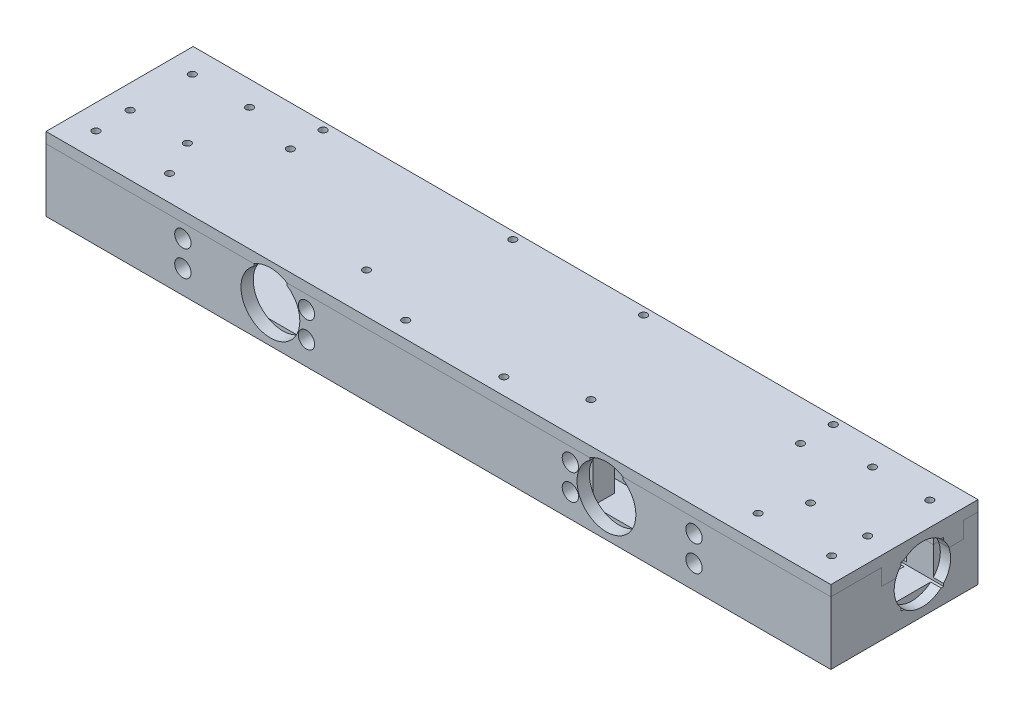
from build123d import *

# Parameters (mm, degrees)
BOSS_EXTRUDE1_DEPTH      = 152.4
BOSS_EXTRUDE1_DEPTH_BACK = 152.4
SKETCH3_W                = 57.15
SKETCH3_H                = 28.575
SKETCH6_W                = 16.51
SKETCH6_H                = 16.51
CUT_EXTRUDE2_DEPTH       = 16.9164
SKETCH7_R                = 10.9728
CUT_EXTRUDE3_DEPTH       = 4.0132
CUT_EXTRUDE4_START       = 2.54
SKETCH8_R                = 10.9728
CUT_EXTRUDE4_DEPTH       = 2.54
CUT_EXTRUDE5_DEPTH       = 25.4
SPLIT1_SURFACE_1_BACK    = 312.425
SPLIT1_SURFACE_1_DEPTH   = 624.85
SPLIT1_SURFACE_2_BACK    = 312.425
SPLIT1_SURFACE_2_DEPTH   = 624.85
CUT_EXTRUDE7_START       = 4.1275
CUT_EXTRUDE7_DEPTH       = 20.32
CUT_EXTRUDE8_DEPTH       = 4.7625
SKETCH16_W               = 7.62
SKETCH16_H               = 5.08
CUT_EXTRUDE9_DEPTH       = 20.32
SKETCH17_W               = 7.62
SKETCH17_H               = 25.6775
BOSS_EXTRUDE2_DEPTH      = 6.35
SKETCH18_W               = 55.24
SKETCH18_H               = 6.0725
BOSS_EXTRUDE3_DEPTH      = 9.525
SKETCH19_W               = 8
SKETCH19_H               = 7.62
CUT_EXTRUDE10_DEPTH      = 7.62
SKETCH20_R               = 3.175
CUT_EXTRUDE11_DEPTH      = 18.1625
SKETCH21_R               = 1.397
CUT_EXTRUDE12_DEPTH      = 25.4
SKETCH28_R               = 11.43
CUT_EXTRUDE16_DEPTH      = 4.7625
BOSS_EXTRUDE5_REACH      = 160.392
SKETCH23_W               = 7.2136
SKETCH23_H               = 6.35
SKETCH24_W               = 55.24
SKETCH24_H               = 6.0725
BOSS_EXTRUDE6_DEPTH      = 3.175
SKETCH25_W               = 205.74
SKETCH25_H               = 25.6775
CUT_EXTRUDE13_DEPTH      = 6.35
SKETCH26_R               = 1.397
CUT_EXTRUDE14_DEPTH      = 25.4
CUT_EXTRUDE15_DEPTH      = 20.32
CUT_EXTRUDE17_DEPTH      = 4.7625


with BuildPart() as part:
    # Sketch3 → Boss-Extrude1 (new, two sides: drawn at the far end of the back side and taken through both)
    with BuildSketch(Plane(origin=(0, 0, 0), x_dir=(0, 0, -1), z_dir=(1, 0, 0)).offset(-BOSS_EXTRUDE1_DEPTH_BACK)):
        with Locations((-6.985, 25.4)):
            Rectangle(SKETCH3_W, SKETCH3_H)
    extrude(amount=BOSS_EXTRUDE1_DEPTH + BOSS_EXTRUDE1_DEPTH_BACK)

    # Sketch6 → Cut-Extrude2 (cut)
    with BuildSketch(Plane(origin=(152.4, 0, 0), x_dir=(0, 0, -1), z_dir=(1, 0, 0))):
        with Locations((0, 25.4)):
            Rectangle(SKETCH6_W, SKETCH6_H)
    cut_extrude2 = extrude(amount=-CUT_EXTRUDE2_DEPTH, mode=Mode.SUBTRACT)

    # Sketch7 → Cut-Extrude3 (cut)
    with BuildSketch(Plane(origin=(152.4, 0, 0), x_dir=(0, 0, -1), z_dir=(1, 0, 0))):
        with Locations((0, 25.4)):
            Circle(SKETCH7_R)
    cut_extrude3 = extrude(amount=-CUT_EXTRUDE3_DEPTH, mode=Mode.SUBTRACT)

    # Sketch8 → Cut-Extrude4 (cut)
    with BuildSketch(Plane(origin=(135.4836, 0, 0), x_dir=(0, 0, -1), z_dir=(1, 0, 0)).offset(CUT_EXTRUDE4_START)):
        with Locations((0, 25.4)):
            Circle(SKETCH8_R)
    cut_extrude4 = extrude(amount=-CUT_EXTRUDE4_DEPTH, mode=Mode.SUBTRACT)

    # Sketch9 → Cut-Extrude5 (cut)
    with BuildSketch(Plane(origin=(135.4836, 0, 0), x_dir=(0, 0, -1), z_dir=(1, 0, 0))):
        with BuildLine():
            Line((7.74954, 32.033075169), (7.74954, 18.766924831))
            ThreePointArc((7.74954, 18.766924831), (0, 15.19936), (-7.74954, 18.766924831))
            Line((-7.74954, 18.766924831), (-7.74954, 32.033075169))
            ThreePointArc((-7.74954, 32.033075169), (0, 35.60064), (7.74954, 32.033075169))
        make_face()
    cut_extrude5 = extrude(amount=-CUT_EXTRUDE5_DEPTH, mode=Mode.SUBTRACT)

    # Mirror1: Cut-Extrude2, Cut-Extrude3, Cut-Extrude4, Cut-Extrude5 across Right Plane
    add(cut_extrude2.mirror(Plane(origin=(0, 0, 0), x_dir=(0, 0, -1), z_dir=(1, 0, 0))), mode=Mode.SUBTRACT)
    add(cut_extrude3.mirror(Plane(origin=(0, 0, 0), x_dir=(0, 0, -1), z_dir=(1, 0, 0))), mode=Mode.SUBTRACT)
    add(cut_extrude4.mirror(Plane(origin=(0, 0, 0), x_dir=(0, 0, -1), z_dir=(1, 0, 0))), mode=Mode.SUBTRACT)
    add(cut_extrude5.mirror(Plane(origin=(0, 0, 0), x_dir=(0, 0, -1), z_dir=(1, 0, 0))), mode=Mode.SUBTRACT)


with BuildPart() as body_2:
    # Split1: the piece behind the surface
    add(part.part)
    # Split1 surface: a surface, the sketch's curves swept straight by 624.85 mm
    with BuildLine(Plane(origin=(0, 0, 0), x_dir=(0, 0, -1), z_dir=(1, 0, 0)).offset(-SPLIT1_SURFACE_1_BACK), mode=Mode.PRIVATE) as split1_surface_1_path:
        Line((-35.56, 35.56), (-15.875, 35.56))
        Line((-15.875, 35.56), (-15.875, 29.21))
        Line((-15.875, 29.21), (0, 29.21))
        Line((0, 29.21), (15.875, 29.21))
        Line((15.875, 29.21), (15.875, 35.56))
        Line((15.875, 35.56), (21.59, 35.56))
    split1_surface_1 = Shell.extrude(split1_surface_1_path.wire(), (1 * SPLIT1_SURFACE_1_DEPTH, 0 * SPLIT1_SURFACE_1_DEPTH, 0 * SPLIT1_SURFACE_1_DEPTH))
    split(bisect_by=split1_surface_1, keep=Keep.BOTTOM)


with BuildPart() as part_1:
    add(part.part)

    # Split1: split by a surface, the side it looks to stays
    # Split1 surface: a surface, the sketch's curves swept straight by 624.85 mm
    with BuildLine(Plane(origin=(0, 0, 0), x_dir=(0, 0, -1), z_dir=(1, 0, 0)).offset(-SPLIT1_SURFACE_2_BACK), mode=Mode.PRIVATE) as split1_surface_2_path:
        Line((-35.56, 35.56), (-15.875, 35.56))
        Line((-15.875, 35.56), (-15.875, 29.21))
        Line((-15.875, 29.21), (0, 29.21))
        Line((0, 29.21), (15.875, 29.21))
        Line((15.875, 29.21), (15.875, 35.56))
        Line((15.875, 35.56), (21.59, 35.56))
    split1_surface_2 = Shell.extrude(split1_surface_2_path.wire(), (1 * SPLIT1_SURFACE_2_DEPTH, 0 * SPLIT1_SURFACE_2_DEPTH, 0 * SPLIT1_SURFACE_2_DEPTH))
    split(bisect_by=split1_surface_2, keep=Keep.TOP)


with BuildPart() as cut_extrude7_tool:
    # Sketch13 → Cut-Extrude7 (new body)
    with BuildSketch(Plane(origin=(0, 11.1125, 0), x_dir=(1, 0, 0), z_dir=(0, 1, 0)).offset(CUT_EXTRUDE7_START)):
        Polygon((-102.87, -15.875), (-102.87, 9.8025), (-95.25, 9.8025), (-95.25, -30.7975), (-55.25, -30.7975), (-55.25, 9.8025), (-47.63, 9.8025), (-47.63, -15.875), (47.63, -15.875), (47.63, 9.8025), (55.25, 9.8025), (55.25, -30.7975), (95.25, -30.7975), (95.25, 9.8025), (102.87, 9.8025), (102.87, -15.875), (110.0836, -15.875), (110.0836, 15.875), (-110.0836, 15.875), (-110.0836, -15.875), align=None)
    extrude(amount=CUT_EXTRUDE7_DEPTH)


with BuildPart() as part_2:
    add(part_1.part)

    # Cut-Extrude7: cut by cut_extrude7_tool
    add(cut_extrude7_tool.part, mode=Mode.SUBTRACT)

    # Sketch24 → Boss-Extrude6 (add)
    with BuildSketch(Plane.XZ.offset(-35.56)):
        with Locations((-75.25, -12.83875)):
            Rectangle(SKETCH24_W, SKETCH24_H)
        with Locations((75.25, -12.83875)):
            Rectangle(SKETCH24_W, SKETCH24_H)
    extrude(amount=BOSS_EXTRUDE6_DEPTH)

    # Sketch25 → Cut-Extrude13 (cut)
    with BuildSketch(Plane.XZ.offset(-29.21)):
        with Locations((0, 3.03625)):
            Rectangle(SKETCH25_W, SKETCH25_H)
    extrude(amount=-CUT_EXTRUDE13_DEPTH, mode=Mode.SUBTRACT)


with BuildPart() as body_2_1:
    add(body_2.part)

    # Cut-Extrude7: cut by cut_extrude7_tool
    add(cut_extrude7_tool.part, mode=Mode.SUBTRACT)

    # Sketch15 → Cut-Extrude8 (cut)
    with BuildSketch(Plane.XY.offset(35.56)):
        with BuildLine():
            Line((-71.7, 25.24), (-71.7, 35.56))
            Line((-71.7, 35.56), (-58.8, 35.56))
            Line((-58.8, 35.56), (-58.8, 25.24))
            ThreePointArc((-58.8, 25.24), (-65.25, 18.79), (-71.7, 25.24))
        make_face()
    cut_extrude8 = extrude(amount=-CUT_EXTRUDE8_DEPTH, mode=Mode.SUBTRACT)

    # Sketch16 → Cut-Extrude9 (cut)
    with BuildSketch(Plane(origin=(0, 35.56, 0), x_dir=(1, 0, 0), z_dir=(0, 1.0, 1.17890261829277e-12))):
        with Locations((-99.06, -19.9375)):
            Rectangle(SKETCH16_W, SKETCH16_H)
        with Locations((-51.44, -19.9375)):
            Rectangle(SKETCH16_W, SKETCH16_H)
    cut_extrude9 = extrude(amount=-CUT_EXTRUDE9_DEPTH, mode=Mode.SUBTRACT)

    # Sketch17 → Boss-Extrude2 (add)
    with BuildSketch(Plane(origin=(0, 29.21, 0), x_dir=(1, 0, 0), z_dir=(0, 1, 0))):
        with Locations((-99.06, -3.03625)):
            Rectangle(SKETCH17_W, SKETCH17_H)
        with Locations((-51.44, -3.03625)):
            Rectangle(SKETCH17_W, SKETCH17_H)
    boss_extrude2 = extrude(amount=BOSS_EXTRUDE2_DEPTH)

    # Sketch18 → Boss-Extrude3 (add)
    with BuildSketch(Plane(origin=(0, 15.24, 0), x_dir=(1, 0, 0), z_dir=(0, 1, 0))):
        with Locations((-75.25, 12.83875)):
            Rectangle(SKETCH18_W, SKETCH18_H)
    boss_extrude3 = extrude(amount=BOSS_EXTRUDE3_DEPTH)

    # Sketch19 → Cut-Extrude10 (cut)
    with BuildSketch(Plane.ZY.offset(55.25)):
        with Locations((-5.8025, 25.4)):
            Rectangle(SKETCH19_W, SKETCH19_H)
    cut_extrude10 = extrude(amount=-CUT_EXTRUDE10_DEPTH, mode=Mode.SUBTRACT)

    # Sketch20 → Cut-Extrude11 (cut)
    with BuildSketch(Plane.XY.offset(35.56)):
        with Locations((-99.25, 20.24)):
            Circle(SKETCH20_R)
        with Locations((-99.25, 30.24)):
            Circle(SKETCH20_R)
        with Locations((-51.25, 20.24)):
            Circle(SKETCH20_R)
        with Locations((-51.25, 30.24)):
            Circle(SKETCH20_R)
    cut_extrude11 = extrude(amount=-CUT_EXTRUDE11_DEPTH, mode=Mode.SUBTRACT)

    # Sketch21 → Cut-Extrude12 (cut)
    with BuildSketch(Plane.XY.offset(17.3975)):
        with Locations(Location((-99.25, 30.24, 0), (0, 0, 270))):
            Circle(SKETCH21_R)
        with Locations(Location((-99.25, 20.24, 0), (0, 0, 270))):
            Circle(SKETCH21_R)
        with Locations(Location((-51.25, 20.24, 0), (0, 0, 270))):
            Circle(SKETCH21_R)
        with Locations(Location((-51.25, 30.24, 0), (0, 0, 270))):
            Circle(SKETCH21_R)
    cut_extrude12 = extrude(amount=-CUT_EXTRUDE12_DEPTH, mode=Mode.SUBTRACT)

    # Sketch28 → Cut-Extrude16 (cut)
    with BuildSketch(Plane.XY.offset(35.56)):
        with Locations((-65.25, 25.24)):
            Circle(SKETCH28_R)
    cut_extrude16 = extrude(amount=-CUT_EXTRUDE16_DEPTH, mode=Mode.SUBTRACT)

    # Mirror2: Cut-Extrude8, Cut-Extrude9 across plane
    add(cut_extrude8.mirror(Plane(origin=(0, 0, 0), x_dir=(0, 0, 1), z_dir=(1, 0, 0))), mode=Mode.SUBTRACT)
    add(cut_extrude9.mirror(Plane(origin=(0, 0, 0), x_dir=(0, 0, 1), z_dir=(1, 0, 0))), mode=Mode.SUBTRACT)

    # Mirror2 2: Boss-Extrude2, Boss-Extrude3 across plane
    add(boss_extrude2.mirror(Plane(origin=(0, 0, 0), x_dir=(0, 0, 1), z_dir=(1, 0, 0))))
    add(boss_extrude3.mirror(Plane(origin=(0, 0, 0), x_dir=(0, 0, 1), z_dir=(1, 0, 0))))

    # Mirror2 3: Cut-Extrude10, Cut-Extrude11, Cut-Extrude12, Cut-Extrude16 across plane
    add(cut_extrude10.mirror(Plane(origin=(0, 0, 0), x_dir=(0, 0, 1), z_dir=(1, 0, 0))), mode=Mode.SUBTRACT)
    add(cut_extrude11.mirror(Plane(origin=(0, 0, 0), x_dir=(0, 0, 1), z_dir=(1, 0, 0))), mode=Mode.SUBTRACT)
    add(cut_extrude12.mirror(Plane(origin=(0, 0, 0), x_dir=(0, 0, 1), z_dir=(1, 0, 0))), mode=Mode.SUBTRACT)
    add(cut_extrude16.mirror(Plane(origin=(0, 0, 0), x_dir=(0, 0, 1), z_dir=(1, 0, 0))), mode=Mode.SUBTRACT)

    # Boss-Extrude5: up to this face of the body (flat: up to its plane)
    boss_extrude5_end = Plane(body_2_1.part.faces().sort_by_distance((-75.25, 15.24, 10.4975))[0])
    # Sketch23 → Boss-Extrude5 (add, up to the picked face)
    with BuildSketch(Plane(origin=(0, 35.56, 0), x_dir=(1, 0, 0), z_dir=(0, 1.0, 1.17890261829277e-12)), mode=Mode.PRIVATE) as boss_extrude5_sk1:
        with Locations((-106.4768, -12.7)):
            Rectangle(SKETCH23_W, SKETCH23_H)
    boss_extrude5_tool1 = split(extrude(boss_extrude5_sk1.sketch, amount=-BOSS_EXTRUDE5_REACH, mode=Mode.PRIVATE), bisect_by=boss_extrude5_end, keep=Keep.BOTH, mode=Mode.PRIVATE)
    # Sketch23 → Boss-Extrude5 (add, up to the picked face)
    with BuildSketch(Plane(origin=(0, 35.56, 0), x_dir=(1, 0, 0), z_dir=(0, 1.0, 1.17890261829277e-12)), mode=Mode.PRIVATE) as boss_extrude5_sk2:
        with Locations((106.4768, -12.7)):
            Rectangle(SKETCH23_W, SKETCH23_H)
    boss_extrude5_tool2 = split(extrude(boss_extrude5_sk2.sketch, amount=-BOSS_EXTRUDE5_REACH, mode=Mode.PRIVATE), bisect_by=boss_extrude5_end, keep=Keep.BOTH, mode=Mode.PRIVATE)
    add(boss_extrude5_tool1.solids().sort_by(Axis((-106.4768, 35.56, 12.7), (0, -1.0, -1.17890261829277e-12)))[0])
    add(boss_extrude5_tool2.solids().sort_by(Axis((106.4768, 35.56, 12.7), (0, -1.0, -1.17890261829277e-12)))[0])


with BuildPart() as cut_extrude14_tool:
    # Sketch26 → Cut-Extrude14 (new body)
    with BuildSketch(Plane(origin=(0, 39.6875, 0), x_dir=(1, 0, 0), z_dir=(0, 1, 0))):
        with Locations(Location((-142.875, -25.7175, 0), (0, 0, 270))):
            Circle(SKETCH26_R)
        with Locations(Location((-114.3, -25.7175, 0), (0, 0, 270))):
            Circle(SKETCH26_R)
        with Locations(Location((-99.06, 5.9925, 0), (0, 0, 270))):
            Circle(SKETCH26_R)
        with Locations(Location((-143.2052, 12.065, 0), (0, 0, 270))):
            Circle(SKETCH26_R)
        with Locations(Location((-120.9802, 12.065, 0), (0, 0, 270))):
            Circle(SKETCH26_R)
        with Locations(Location((-143.2052, -12.065, 0), (0, 0, 270))):
            Circle(SKETCH26_R)
        with Locations(Location((-120.9802, -12.065, 0), (0, 0, 270))):
            Circle(SKETCH26_R)
        with Locations(Location((-99.06, 18.7325, 0), (0, 0, 270))):
            Circle(SKETCH26_R)
        with Locations(Location((-25.4, 18.7325, 0), (0, 0, 270))):
            Circle(SKETCH26_R)
        with Locations(Location((-43.5675, -19.9375, 0), (0, 0, 270))):
            Circle(SKETCH26_R)
        with Locations(Location((-19.05, -29.21, 0), (0, 0, 270))):
            Circle(SKETCH26_R)
    cut_extrude14 = extrude(amount=-CUT_EXTRUDE14_DEPTH)


with BuildPart() as part_3:
    add(part_2.part)

    # Cut-Extrude14: cut by cut_extrude14_tool
    add(cut_extrude14_tool.part, mode=Mode.SUBTRACT)


with BuildPart() as body_2_2:
    add(body_2_1.part)

    # Cut-Extrude14: cut by cut_extrude14_tool
    add(cut_extrude14_tool.part, mode=Mode.SUBTRACT)


with BuildPart() as mirror3_tool:
    # Mirror3: Cut-Extrude14 across plane
    add(cut_extrude14.mirror(Plane(origin=(0, 0, 0), x_dir=(0, 0, 1), z_dir=(1, 0, 0))))


with BuildPart() as part_4:
    add(part_3.part)

    # Mirror3: cut by mirror3_tool
    add(mirror3_tool.part, mode=Mode.SUBTRACT)

    # Sketch31 → Cut-Extrude17 (cut)
    with BuildSketch(Plane.XY.offset(35.56)):
        with BuildLine():
            Line((-71.7, 35.56), (-58.8, 35.56))
            ThreePointArc((-58.8, 35.56), (-65.25, 37.40983566), (-71.7, 35.56))
        make_face()
        with BuildLine():
            Line((58.8, 35.56), (71.7, 35.56))
            ThreePointArc((71.7, 35.56), (65.25, 37.40983566), (58.8, 35.56))
        make_face()
    extrude(amount=-CUT_EXTRUDE17_DEPTH, mode=Mode.SUBTRACT)


with BuildPart() as body_2_3:
    add(body_2_2.part)

    # Mirror3: cut by mirror3_tool
    add(mirror3_tool.part, mode=Mode.SUBTRACT)

    # Sketch27 → Cut-Extrude15 (cut)
    with BuildSketch(Plane(origin=(0, 35.56, 0), x_dir=(1, 0, 0), z_dir=(0, 1.0, 1.17890261829277e-12))):
        Polygon((-40.01, -15.875), (-34.144121265, -26.035), (34.144121265, -26.035), (40.01, -15.875), align=None)
    extrude(amount=-CUT_EXTRUDE15_DEPTH, mode=Mode.SUBTRACT)


solid = Compound([part_4.part, body_2_3.part])
